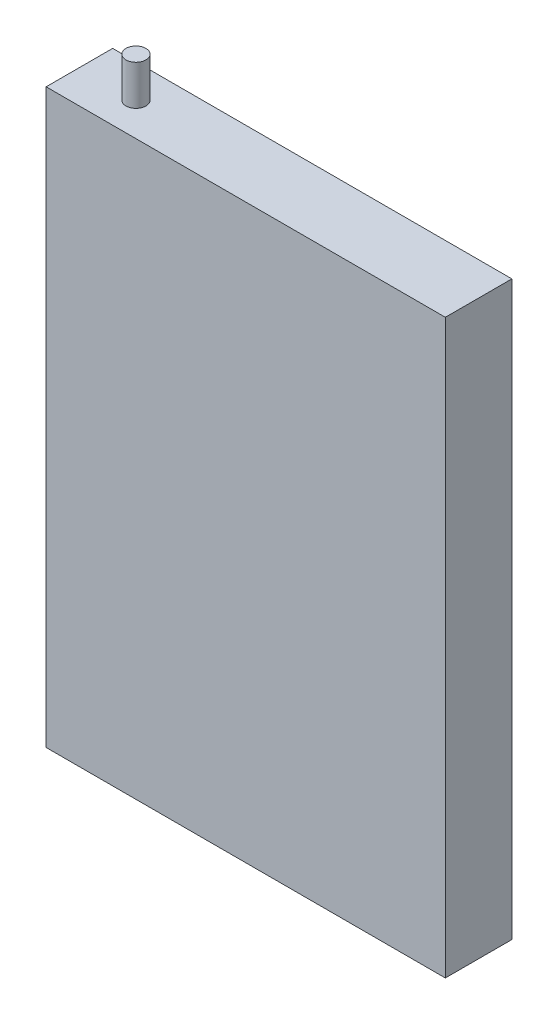
from build123d import *

# Parameters (mm, degrees)
SKETCH1_W           = 60
SKETCH1_H           = 86
BOSS_EXTRUDE1_DEPTH = 10
SKETCH2_R           = 1.5
BOSS_EXTRUDE2_DEPTH = 6


with BuildPart() as part:
    # Sketch1 → Boss-Extrude1 (new body)
    with BuildSketch(Plane.XY):
        with Locations((30, -43)):
            Rectangle(SKETCH1_W, SKETCH1_H)
    extrude(amount=BOSS_EXTRUDE1_DEPTH)

    # Sketch2 → Boss-Extrude2 (add)
    with BuildSketch(Plane(origin=(0, 0, 0), x_dir=(1, 0, 0), z_dir=(0, 1, 0))):
        with Locations(Location((8.5, -5, 0), (0, 0, 90))):
            Circle(SKETCH2_R)
    extrude(amount=BOSS_EXTRUDE2_DEPTH)


solid = part.part
